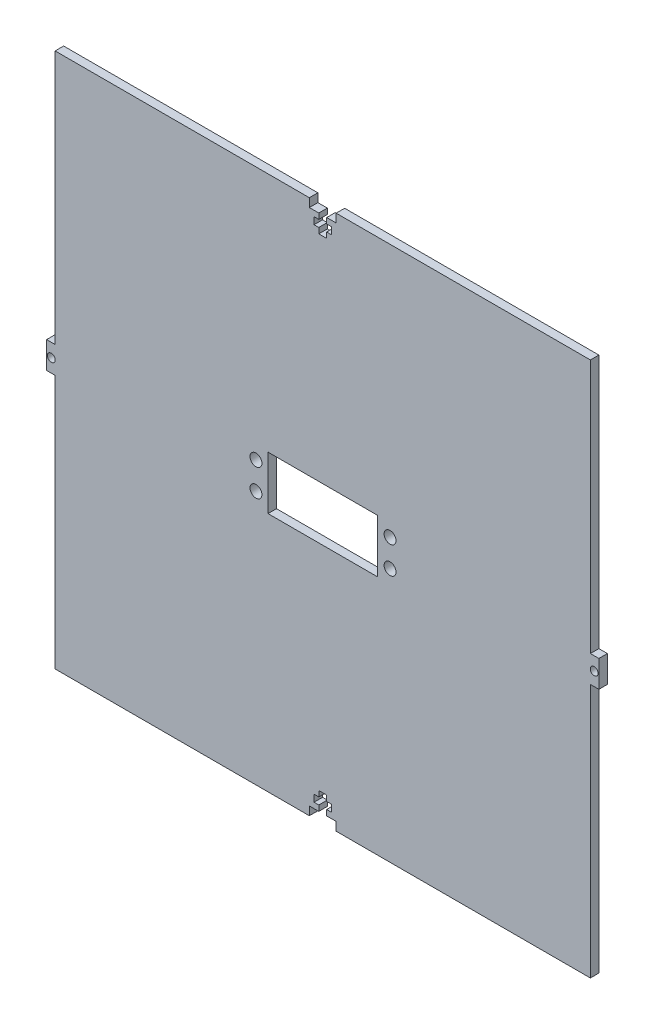
from build123d import *

# Parameters (mm, degrees)
SKETCH2_W           = 200
SKETCH2_H           = 200
BOSS_EXTRUDE1_DEPTH = 3.18
CUT_EXTRUDE1_DEPTH  = 142.457104452
SKETCH4_W           = 3.18
SKETCH4_H           = 10
BOSS_EXTRUDE2_DEPTH = 3.18
SKETCH6_R           = 1.47
CUT_EXTRUDE2_DEPTH  = 144.722735849
SKETCH8_W           = 40.9
SKETCH8_H           = 19.9
CUT_EXTRUDE4_DEPTH  = 144.722735849
SKETCH10_R          = 2.2225
CUT_EXTRUDE6_DEPTH  = 144.722735849


with BuildPart() as part:
    # Sketch2 → Boss-Extrude1 (new body)
    with BuildSketch(Plane.XY):
        Rectangle(SKETCH2_W, SKETCH2_H)
    extrude(amount=BOSS_EXTRUDE1_DEPTH)

    # Sketch3 → Cut-Extrude1 (cut, through all)
    with BuildSketch(Plane.XY.offset(3.18)):
        Polygon((-5, 100), (5, 100), (5, 96.82), (1.47, 96.82), (1.47, 94.74), (3.25, 94.74), (3.25, 92.14), (1.47, 92.14), (1.47, 90.07), (-1.47, 90.07), (-1.47, 92.14), (-3.25, 92.14), (-3.25, 94.74), (-1.47, 94.74), (-1.47, 96.82), (-5, 96.82), align=None)
        Polygon((1.47, -96.82), (5, -96.82), (5, -100), (-5, -100), (-5, -96.82), (-1.47, -96.82), (-1.47, -94.74), (-3.25, -94.74), (-3.25, -92.14), (-1.47, -92.14), (-1.47, -90.07), (1.47, -90.07), (1.47, -92.14), (3.25, -92.14), (3.25, -94.74), (1.47, -94.74), align=None)
    extrude(amount=-CUT_EXTRUDE1_DEPTH, mode=Mode.SUBTRACT)

    # Sketch4 → Boss-Extrude2 (add)
    with BuildSketch(Plane.ZY.offset(100)):
        with Locations((1.59, 0)):
            Rectangle(SKETCH4_W, SKETCH4_H)
    boss_extrude2 = extrude(amount=BOSS_EXTRUDE2_DEPTH)

    # Sketch6 → Cut-Extrude2 (cut, through all)
    with BuildSketch(Plane.XY.offset(3.18)):
        with Locations((-101.43, 0)):
            Circle(SKETCH6_R)
    cut_extrude2 = extrude(amount=-CUT_EXTRUDE2_DEPTH, mode=Mode.SUBTRACT)

    # Mirror1: Boss-Extrude2 across plane
    add(boss_extrude2.mirror(Plane(origin=(0, 0, 0), x_dir=(0, 0, 1), z_dir=(1, 0, 0))))

    # Mirror2: Cut-Extrude2 across plane
    add(cut_extrude2.mirror(Plane(origin=(0, 0, 0), x_dir=(0, 0, 1), z_dir=(1, 0, 0))), mode=Mode.SUBTRACT)

    # Sketch8 → Cut-Extrude4 (cut, through all)
    with BuildSketch(Plane.XY.offset(3.18)):
        Rectangle(SKETCH8_W, SKETCH8_H)
    extrude(amount=-CUT_EXTRUDE4_DEPTH, mode=Mode.SUBTRACT)

    # Sketch10 → Cut-Extrude6 (cut, through all)
    with BuildSketch(Plane.XY.offset(3.18)):
        with Locations((-24.949, 5.1875)):
            Circle(SKETCH10_R)
        with Locations((-24.949, -4.9725)):
            Circle(SKETCH10_R)
        with Locations((25.149, 5.1875)):
            Circle(SKETCH10_R)
        with Locations((25.149, -4.9725)):
            Circle(SKETCH10_R)
    extrude(amount=-CUT_EXTRUDE6_DEPTH, mode=Mode.SUBTRACT)


solid = part.part
